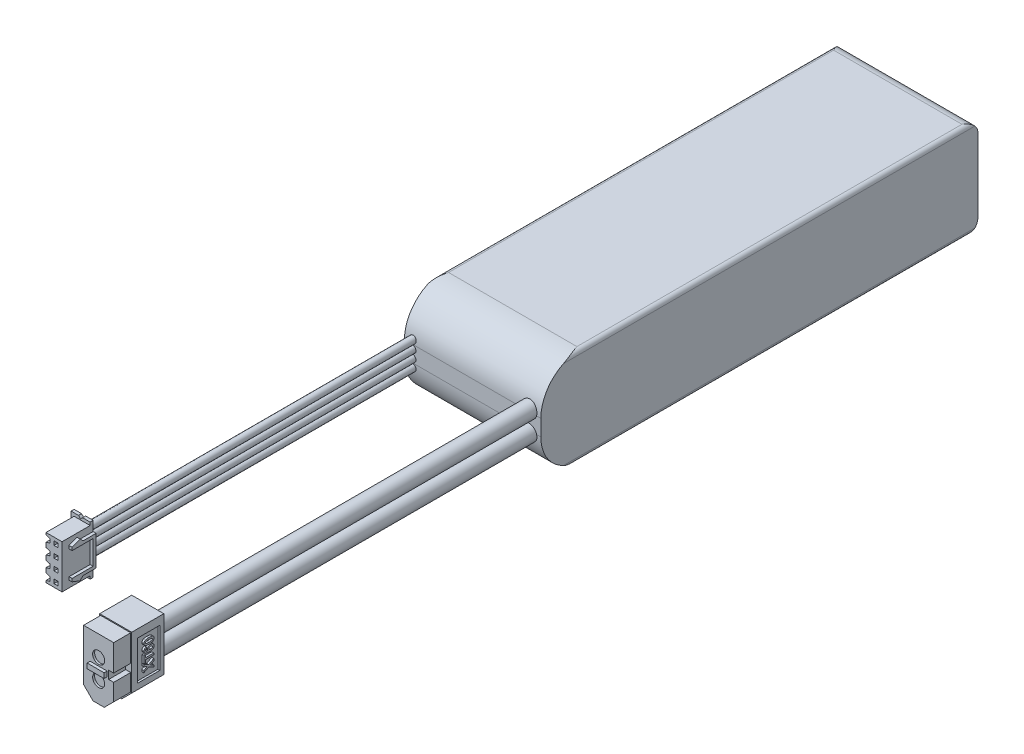
from build123d import *
from OCP.BRepFilletAPI import BRepFilletAPI_MakeFillet

# Parameters (mm, degrees)
SKETCH1_W            = 34
SKETCH1_H            = 24
BOSS_EXTRUDE1_DEPTH  = 109
FILLET1_R1           = 3
FILLET1_R2           = 1
FILLET1_R3           = 10
SKETCH2_R            = 2
BOSS_EXTRUDE6_DEPTH  = 8
BOSS_EXTRUDE7_START  = 8
BOSS_EXTRUDE7_DEPTH  = 4.25
BOSS_EXTRUDE8_START  = 12.25
SKETCH4_5_W          = 4.25
SKETCH4_5_H          = 1.25
BOSS_EXTRUDE8_DEPTH  = 0.75
CUT_EXTRUDE2_START   = 12.25
SKETCH4_7_R          = 1.5
CUT_EXTRUDE2_DEPTH   = 0.5
SKETCH7_W            = 5.5
SKETCH7_H            = 9.75
CUT_EXTRUDE3_DEPTH   = 0.5
BOSS_EXTRUDE12_DEPTH = 0.5
SKETCH9_R            = 0.875
BOSS_EXTRUDE10_DEPTH = 0.75
SKETCH11_4_W         = 4
SKETCH11_4_H         = 10.85
BOSS_EXTRUDE11_DEPTH = 7.75
SKETCH14_W           = 1
SKETCH14_H           = 1
CUT_EXTRUDE4_DEPTH   = 1
CUT_EXTRUDE5_DEPTH   = 3.5
BOSS_EXTRUDE13_DEPTH = 0.75


with BuildPart() as part:
    # Sketch1 → Boss-Extrude1 (new body)
    with BuildSketch(Plane.XY):
        Rectangle(SKETCH1_W, SKETCH1_H)
    extrude(amount=BOSS_EXTRUDE1_DEPTH)

    # Fillet1: one fillet with a radius per group of edges: ONE call of the kernel's fillet builder (fillet() takes one radius for all edges)
    fillet1_edges_1 = [part.edges().sort_by_distance(p)[0] for p in [
        (0, 12, 0),
        (0, -12, 0),
    ]]
    fillet1_edges_2 = [part.edges().sort_by_distance(p)[0] for p in [
        (17, 12, 54.5),
        (-17, 12, 54.5),
        (17, -12, 54.5),
        (-17, -12, 54.5),
    ]]
    fillet1_edges_3 = [part.edges().sort_by_distance(p)[0] for p in [
        (0, 12, 109),
        (0, -12, 109),
    ]]
    fillet1 = BRepFilletAPI_MakeFillet(part.part.solid().wrapped)
    for e in fillet1_edges_1:
        fillet1.Add(FILLET1_R1, e.wrapped)
    for e in fillet1_edges_2:
        fillet1.Add(FILLET1_R2, e.wrapped)
    for e in fillet1_edges_3:
        fillet1.Add(FILLET1_R3, e.wrapped)
    add(Compound.cast(fillet1.Shape()), mode=Mode.REPLACE)

    # Power wires: sweep along a path in Sketch3
    with BuildLine(Plane(origin=(0, 0, 0), x_dir=(1, 0, 0), z_dir=(0, 1, 0))) as power_wires_path:
        Line((14, -204), (14, -109))
        Line((14, -109), (14, -108))
    # Sketch2 → Power wires (sweep)
    with BuildSketch(Plane.XY.offset(109)):
        with Locations((14, -2.5)):
            Circle(SKETCH2_R)
        with Locations((14, 2.5)):
            Circle(SKETCH2_R)
    sweep(path=power_wires_path.line)

    # Sketch4 → Boss-Extrude6 (add)
    with BuildSketch(Plane.XY.offset(204)):
        Polygon((10, -5.325), (12.5, -7.825), (15.5, -7.825), (18, -5.325), (18, 7.825), (10, 7.825), align=None)
    extrude(amount=BOSS_EXTRUDE6_DEPTH)

    # Sketch4<3> → Boss-Extrude7 (add)
    with BuildSketch(Plane.XY.offset(204).offset(BOSS_EXTRUDE7_START)):
        Polygon((10.25, -5.221446609), (12.603553391, -7.575), (15.396446609, -7.575), (17.75, -5.221446609), (17.75, -1), (16.5, -1), (16.5, 1), (17.75, 1), (17.75, 7.575), (10.25, 7.575), align=None)
    extrude(amount=BOSS_EXTRUDE7_DEPTH)

    # Sketch4<5> → Boss-Extrude8 (add)
    with BuildSketch(Plane.XY.offset(204).offset(BOSS_EXTRUDE8_START)):
        with Locations((14, 0)):
            Rectangle(SKETCH4_5_W, SKETCH4_5_H)
    extrude(amount=BOSS_EXTRUDE8_DEPTH)

    # Sketch4<7> → Cut-Extrude2 (cut)
    with BuildSketch(Plane.XY.offset(204).offset(CUT_EXTRUDE2_START)):
        with Locations(Location((14, 2.5, 0), (0, 0, 180))):
            Circle(SKETCH4_7_R)
        with Locations(Location((14, -2.5, 0), (0, 0, 180))):
            Circle(SKETCH4_7_R)
    extrude(amount=-CUT_EXTRUDE2_DEPTH, mode=Mode.SUBTRACT)

    # Sketch7 → Cut-Extrude3 (cut)
    with BuildSketch(Plane(origin=(18, 0, 0), x_dir=(0, 0, -1), z_dir=(1, 0, 0))):
        with Locations((-207.75, 0.95)):
            Rectangle(SKETCH7_W, SKETCH7_H)
    extrude(amount=-CUT_EXTRUDE3_DEPTH, mode=Mode.SUBTRACT)

    # Sketch15 → Boss-Extrude12 (add)
    # profile 1 of 4: a face of its own
    with BuildSketch(Plane(origin=(17.5, 0, 0), x_dir=(0, 0, -1), z_dir=(1, 0, 0))):
        Polygon((-206.5, -0.590039063), (-206.5, -1.122265625), (-207.336914063, -1.540234375), (-206.5, -1.958203125), (-206.5, -2.4875), (-207.758789063, -1.793164063), (-209, -2.454785156), (-209, -1.922558594), (-208.170410156, -1.540234375), (-209, -1.137402344), (-209, -0.608105469), (-207.775878906, -1.281933594), align=None)
    # profile 2 of 4: a face of its own
    with BuildSketch(Plane(origin=(17.5, 0, 0), x_dir=(0, 0, -1), z_dir=(1, 0, 0))):
        Polygon((-208.59375, 1.237597656), (-208.59375, 0.60625), (-206.5, 0.60625), (-206.5, 0.16875), (-208.59375, 0.16875), (-208.59375, -0.51875), (-209, -0.51875), (-209, 1.237597656), align=None)
    # profile 3 of 4: a face of its own
    with BuildSketch(Plane(origin=(17.5, 0, 0), x_dir=(0, 0, -1), z_dir=(1, 0, 0))):
        with BuildLine():
            add(Edge.make_bspline(
                [(-207.291015625, 2.85625), (-207.259578609, 2.855750657), (-207.197863786, 2.854770384), (-207.107626006, 2.845226266), (-207.021769937, 2.830189033), (-206.940308723, 2.80937819), (-206.863295129, 2.7817709), (-206.790505796, 2.748674975), (-206.721811867, 2.709711994), (-206.680033721, 2.678480285), (-206.659179688, 2.662890625)],
                knots=[0, 0, 0, 0, 1.120225603, 2.199143976, 3.230208243, 4.225038561, 5.192076741, 6.142261994, 7.072689081, 8, 8, 8, 8], degree=3))
            add(Edge.make_bspline(
                [(-206.659179688, 2.662890625), (-206.639115856, 2.645710218), (-206.599613072, 2.611884479), (-206.547495154, 2.554956602), (-206.503725826, 2.493377326), (-206.467759306, 2.427724543), (-206.440540963, 2.357665749), (-206.420184986, 2.283967329), (-206.408406954, 2.205750666), (-206.406979671, 2.152187694), (-206.40625, 2.124804687)],
                knots=[0, 0, 0, 0, 1.027724029, 2.023440042, 2.995775062, 3.96270605, 4.929948432, 5.915307429, 6.9342423, 8, 8, 8, 8], degree=3))
            add(Edge.make_bspline(
                [(-206.40625, 2.124804687), (-206.406672975, 2.10591639), (-206.407502435, 2.0688762), (-206.41261802, 2.01425993), (-206.422849325, 1.962215147), (-206.4349811, 1.911961117), (-206.452476991, 1.864629684), (-206.472828839, 1.819366934), (-206.497536166, 1.776642791), (-206.525827888, 1.736149428), (-206.557884062, 1.697812537), (-206.593349233, 1.66152427), (-206.633397711, 1.628509466), (-206.676345382, 1.596933233), (-206.723593622, 1.56828708), (-206.774135834, 1.541351899), (-206.828790219, 1.51741842), (-206.866783615, 1.503507169), (-206.886230469, 1.496386719)],
                knots=[0, 0, 0, 0, 1.063314927, 2.085173921, 3.082384147, 4.046692111, 4.991392734, 5.917883794, 6.837145235, 7.764767902, 8.694920371, 9.647186329, 10.616052668, 11.612884102, 12.645161535, 13.722940264, 14.834490973, 16, 16, 16, 16], degree=3))
            add(Edge.make_bspline(
                [(-206.886230469, 1.496386719), (-206.913638121, 1.487579912), (-206.97134735, 1.469036404), (-207.06404859, 1.44708317), (-207.166603718, 1.428630191), (-207.278754179, 1.413961105), (-207.400676688, 1.401429111), (-207.532477729, 1.393796789), (-207.674101339, 1.387963682), (-207.771802888, 1.387657924), (-207.822265625, 1.3875)],
                knots=[0, 0, 0, 0, 0.729969758, 1.537015714, 2.413984749, 3.3720892, 4.405214479, 5.522074019, 6.720154102, 8, 8, 8, 8], degree=3))
            add(Edge.make_bspline(
                [(-207.822265625, 1.3875), (-207.861347986, 1.387997046), (-207.937837878, 1.388969836), (-208.050022142, 1.398506682), (-208.156909557, 1.413791259), (-208.258325244, 1.435933698), (-208.354429158, 1.463533519), (-208.445035646, 1.49784346), (-208.530467159, 1.538105007), (-208.583589096, 1.570304536), (-208.609863281, 1.586230469)],
                knots=[0, 0, 0, 0, 1.138883295, 2.228961089, 3.278899592, 4.283815446, 5.252133434, 6.190471817, 7.105004804, 8, 8, 8, 8], degree=3))
            add(Edge.make_bspline(
                [(-208.609863281, 1.586230469), (-208.635815625, 1.604092221), (-208.686380041, 1.638893281), (-208.753778427, 1.698702363), (-208.810466702, 1.76359821), (-208.856877328, 1.833197529), (-208.8936599, 1.907378522), (-208.918622313, 1.986826007), (-208.935156729, 2.070571502), (-208.936708234, 2.128140742), (-208.9375, 2.157519531)],
                knots=[0, 0, 0, 0, 1.095943296, 2.135288202, 3.12716094, 4.087262849, 5.039981056, 5.998543803, 6.978614991, 8, 8, 8, 8], degree=3))
            add(Edge.make_bspline(
                [(-208.9375, 2.157519531), (-208.937036875, 2.180486858), (-208.936127884, 2.225565606), (-208.928825827, 2.291598556), (-208.916130293, 2.354325952), (-208.898437607, 2.413567136), (-208.876507077, 2.469820289), (-208.849140422, 2.522774623), (-208.816157903, 2.572055672), (-208.779060869, 2.618142278), (-208.737618316, 2.660154381), (-208.692150647, 2.697369803), (-208.642824388, 2.729384279), (-208.589895609, 2.756207453), (-208.533468968, 2.778254249), (-208.473468254, 2.795293027), (-208.409940244, 2.807777692), (-208.366101858, 2.811422747), (-208.34375, 2.81328125)],
                knots=[0, 0, 0, 0, 1.116390255, 2.191176803, 3.224684108, 4.223596322, 5.19337685, 6.155996882, 7.115032937, 8.07151949, 9.028300563, 9.978646994, 10.922382238, 11.881385651, 12.858530526, 13.862818652, 14.910316285, 16, 16, 16, 16], degree=3))
            Line((-208.34375, 2.81328125), (-208.349609375, 2.436328125))
            add(Edge.make_bspline(
                [(-208.349609375, 2.436328125), (-208.36642363, 2.430304047), (-208.39890429, 2.418667133), (-208.442487517, 2.393933887), (-208.479744502, 2.365566229), (-208.51037456, 2.332677805), (-208.533945793, 2.295213265), (-208.55078775, 2.253399777), (-208.560593678, 2.207286755), (-208.561849472, 2.1751458), (-208.5625, 2.158496094)],
                knots=[0, 0, 0, 0, 1.132133916, 2.186980998, 3.16667511, 4.095341759, 5.024180857, 5.960576271, 6.943534588, 8, 8, 8, 8], degree=3))
            add(Edge.make_bspline(
                [(-208.5625, 2.158496094), (-208.562233125, 2.146249997), (-208.56170911, 2.122204472), (-208.554366375, 2.087328686), (-208.543694594, 2.054107465), (-208.528437003, 2.022707504), (-208.508733386, 1.993127469), (-208.484370132, 1.965827975), (-208.456451487, 1.939513177), (-208.423721502, 1.916027503), (-208.387781946, 1.894604961), (-208.348794159, 1.876080609), (-208.307480877, 1.859761128), (-208.263186179, 1.847468336), (-208.216678859, 1.836767691), (-208.167122405, 1.830452571), (-208.11499936, 1.825744917), (-208.079276247, 1.825251798), (-208.061035156, 1.825)],
                knots=[0, 0, 0, 0, 0.874754798, 1.717603398, 2.53893307, 3.367170322, 4.207036235, 5.073689834, 5.980200498, 6.946958764, 7.949670247, 8.970680773, 10.032653328, 11.123733316, 12.256894092, 13.444472534, 14.695085528, 16, 16, 16, 16], degree=3))
            add(Edge.make_bspline(
                [(-208.061035156, 1.825), (-208.034798217, 1.825527724), (-207.981207926, 1.826605627), (-207.928024558, 1.833301214), (-207.900878906, 1.83671875)],
                knots=[0, 0, 0, 0, 0.979167629, 2, 2, 2, 2], degree=3))
            add(Edge.make_bspline(
                [(-207.900878906, 1.83671875), (-207.916260452, 1.852117482), (-207.945934592, 1.881824777), (-207.984996413, 1.928561301), (-208.018756452, 1.97435997), (-208.045475576, 2.020387074), (-208.066936859, 2.065533352), (-208.082212873, 2.110382579), (-208.092075583, 2.154810034), (-208.093199595, 2.184489859), (-208.09375, 2.199023437)],
                knots=[0, 0, 0, 0, 1.239550291, 2.391345395, 3.467278255, 4.477282722, 5.419075054, 6.310624888, 7.172748962, 8, 8, 8, 8], degree=3))
            add(Edge.make_bspline(
                [(-208.09375, 2.199023437), (-208.093037852, 2.22395175), (-208.091650346, 2.272520623), (-208.082465973, 2.343432725), (-208.066237444, 2.410162562), (-208.04389505, 2.472987368), (-208.014740985, 2.53155637), (-207.979597258, 2.586289347), (-207.937002388, 2.636048581), (-207.889159855, 2.682367043), (-207.834660663, 2.723394897), (-207.774184724, 2.759110087), (-207.707973641, 2.789566512), (-207.635620082, 2.813603359), (-207.557848771, 2.833351373), (-207.474026973, 2.846778554), (-207.384421346, 2.854430612), (-207.32276904, 2.855631496), (-207.291015625, 2.85625)],
                knots=[0, 0, 0, 0, 1.016496444, 1.980482438, 2.909282339, 3.811988147, 4.693512433, 5.571607283, 6.457070192, 7.358310964, 8.282165599, 9.231440416, 10.217383171, 11.247887857, 12.336023617, 13.486034316, 14.705206621, 16, 16, 16, 16], degree=3))
        make_face()
        with BuildLine():
            add(Edge.make_bspline(
                [(-207.321777344, 2.45), (-207.338227707, 2.449918888), (-207.370365182, 2.449760427), (-207.416934214, 2.445458039), (-207.460921241, 2.440055818), (-207.5017324, 2.430926272), (-207.540194337, 2.420670938), (-207.575340764, 2.406504429), (-207.608345019, 2.391441402), (-207.637642421, 2.372510861), (-207.663956703, 2.35210652), (-207.687471492, 2.330181823), (-207.706409848, 2.305498888), (-207.722076544, 2.279358745), (-207.735275822, 2.251781974), (-207.743864934, 2.221920829), (-207.748702733, 2.190229307), (-207.74956039, 2.168604013), (-207.75, 2.157519531)],
                knots=[0, 0, 0, 0, 1.354073793, 2.645322252, 3.849077002, 5.00057718, 6.086883735, 7.12238405, 8.117628637, 9.069598867, 9.986576526, 10.858766831, 11.708735397, 12.538596173, 13.366180532, 14.218681913, 15.086949458, 16, 16, 16, 16], degree=3))
            add(Edge.make_bspline(
                [(-207.75, 2.157519531), (-207.749675408, 2.145932811), (-207.749034811, 2.123065867), (-207.742371331, 2.089400595), (-207.731671961, 2.057257876), (-207.716831767, 2.026507413), (-207.697586611, 1.997460364), (-207.673720561, 1.970195973), (-207.646521896, 1.943530949), (-207.614543776, 1.919528251), (-207.57978207, 1.896826739), (-207.541282058, 1.87821529), (-207.500629213, 1.861010291), (-207.456546462, 1.848464862), (-207.410215604, 1.837328987), (-207.360853822, 1.830268452), (-207.30884133, 1.825791144), (-207.273121981, 1.825267424), (-207.254882813, 1.825)],
                knots=[0, 0, 0, 0, 0.838204484, 1.654236536, 2.474259819, 3.286109908, 4.119743769, 4.989110372, 5.906075801, 6.872682158, 7.879764388, 8.907669703, 9.964892519, 11.072432114, 12.221831409, 13.413718623, 14.679381833, 16, 16, 16, 16], degree=3))
            add(Edge.make_bspline(
                [(-207.254882813, 1.825), (-207.225022303, 1.825959846), (-207.167275352, 1.827816082), (-207.084074445, 1.844155328), (-207.008318627, 1.871520346), (-206.951210575, 1.903159429), (-206.910997606, 1.932846375), (-206.884714023, 1.956466093), (-206.862510827, 1.981478143), (-206.844391265, 2.007936401), (-206.829957577, 2.03558834), (-206.819529023, 2.064612243), (-206.813636777, 2.095105601), (-206.812880855, 2.115828678), (-206.8125, 2.126269531)],
                knots=[0, 0, 0, 0, 1.815779699, 3.511518798, 5.134513937, 6.699693824, 7.46432505, 8.172542783, 8.84618875, 9.494530984, 10.119137765, 10.739410505, 11.364880491, 12, 12, 12, 12], degree=3))
            add(Edge.make_bspline(
                [(-206.8125, 2.126269531), (-206.812749449, 2.138357582), (-206.813235885, 2.161929827), (-206.82074339, 2.196110039), (-206.831201327, 2.228849281), (-206.847058515, 2.259402438), (-206.866751922, 2.288413868), (-206.891693222, 2.314540501), (-206.920081994, 2.339889704), (-206.953268824, 2.362439654), (-206.989837063, 2.382719823), (-207.029027768, 2.401073111), (-207.071174132, 2.415898103), (-207.115772086, 2.428825956), (-207.163298248, 2.438466069), (-207.213699924, 2.445257984), (-207.266868318, 2.449063934), (-207.303216841, 2.449683588), (-207.321777344, 2.45)],
                knots=[0, 0, 0, 0, 0.862241869, 1.68141048, 2.49085395, 3.312991769, 4.132738568, 4.988993667, 5.887599157, 6.849365453, 7.849495963, 8.875021322, 9.938647566, 11.039794136, 12.192122389, 13.401539835, 14.673158577, 16, 16, 16, 16], degree=3))
        make_face(mode=Mode.SUBTRACT)
    # profile 4 of 4: a face of its own
    with BuildSketch(Plane(origin=(17.5, 0, 0), x_dir=(0, 0, -1), z_dir=(1, 0, 0))):
        with BuildLine():
            add(Edge.make_bspline(
                [(-207.6875, 4.54375), (-207.641433186, 4.543365535), (-207.552359392, 4.542622141), (-207.423229985, 4.537206094), (-207.303196607, 4.528590223), (-207.192220396, 4.516635797), (-207.090446004, 4.5008396), (-206.998169496, 4.480561945), (-206.914422008, 4.458472287), (-206.862979225, 4.438867393), (-206.838378906, 4.429492187)],
                knots=[0, 0, 0, 0, 1.283351493, 2.481460683, 3.599894811, 4.6354175, 5.590360189, 6.467286743, 7.267045185, 8, 8, 8, 8], degree=3))
            add(Edge.make_bspline(
                [(-206.838378906, 4.429492187), (-206.822150954, 4.422404625), (-206.790166393, 4.408435359), (-206.744876445, 4.383716884), (-206.702120915, 4.357650308), (-206.663088264, 4.32850871), (-206.62662974, 4.297934608), (-206.593952595, 4.264455957), (-206.564084358, 4.229224064), (-206.536901229, 4.192085392), (-206.513683402, 4.152285547), (-206.492813337, 4.110701701), (-206.476018999, 4.066573624), (-206.461560544, 4.020514042), (-206.451079716, 3.972093481), (-206.443310673, 3.92171279), (-206.438159607, 3.869214462), (-206.437722902, 3.833475967), (-206.4375, 3.815234375)],
                knots=[0, 0, 0, 0, 1.083396424, 2.1353254, 3.155448726, 4.145753585, 5.113963313, 6.065004106, 7.005128718, 7.939747428, 8.87775821, 9.822306467, 10.784345916, 11.764374699, 12.774721821, 13.813166405, 14.883799469, 16, 16, 16, 16], degree=3))
            add(Edge.make_bspline(
                [(-206.4375, 3.815234375), (-206.437722863, 3.796992764), (-206.43815949, 3.761254231), (-206.443311115, 3.708756173), (-206.451078131, 3.658374506), (-206.461566215, 3.609957438), (-206.47599868, 3.563885347), (-206.492939446, 3.519666008), (-206.513549287, 3.477793801), (-206.536895522, 3.437884293), (-206.564240788, 3.400726209), (-206.593786114, 3.36506147), (-206.626630245, 3.331546187), (-206.663244324, 3.301035548), (-206.701937821, 3.271262423), (-206.745025502, 3.245383073), (-206.79012602, 3.220045057), (-206.822140956, 3.205773619), (-206.838378906, 3.198535156)],
                knots=[0, 0, 0, 0, 1.114012558, 2.182546968, 3.218955996, 4.227322638, 5.205430371, 6.165584032, 7.117205123, 8.053377218, 8.986163891, 9.932053842, 10.881230407, 11.847542252, 12.841839694, 13.859963376, 14.914575071, 16, 16, 16, 16], degree=3))
            add(Edge.make_bspline(
                [(-206.838378906, 3.198535156), (-206.863307574, 3.188552969), (-206.915542805, 3.167636413), (-207.000035129, 3.142741534), (-207.093427252, 3.122042099), (-207.195227744, 3.104376726), (-207.305955568, 3.091693451), (-207.425308749, 3.081857313), (-207.553490731, 3.076053482), (-207.641921205, 3.075358307), (-207.6875, 3.075)],
                knots=[0, 0, 0, 0, 0.746149865, 1.563473513, 2.44485867, 3.404393639, 4.43419012, 5.541857693, 6.733025404, 8, 8, 8, 8], degree=3))
            add(Edge.make_bspline(
                [(-207.6875, 3.075), (-207.733078795, 3.075358307), (-207.821509269, 3.076053482), (-207.949691251, 3.081857313), (-208.069044432, 3.091693451), (-208.179772256, 3.104376726), (-208.281572748, 3.122042099), (-208.374964871, 3.142741534), (-208.459457195, 3.167636413), (-208.511692426, 3.188552969), (-208.536621094, 3.198535156)],
                knots=[0, 0, 0, 0, 1.266974596, 2.458142307, 3.56580988, 4.595606361, 5.55514133, 6.436526487, 7.253850135, 8, 8, 8, 8], degree=3))
            add(Edge.make_bspline(
                [(-208.536621094, 3.198535156), (-208.552859044, 3.205773619), (-208.58487398, 3.220045057), (-208.629974498, 3.245383073), (-208.673062179, 3.271262423), (-208.711755676, 3.301035548), (-208.748369755, 3.331546187), (-208.781213886, 3.36506147), (-208.810759212, 3.400726209), (-208.838104478, 3.437884293), (-208.861450713, 3.477793801), (-208.882060554, 3.519666008), (-208.89900132, 3.563885347), (-208.913433785, 3.609957438), (-208.923921869, 3.658374506), (-208.931688885, 3.708756173), (-208.93684051, 3.761254231), (-208.937277137, 3.796992764), (-208.9375, 3.815234375)],
                knots=[0, 0, 0, 0, 1.085424929, 2.140036624, 3.158160306, 4.152457748, 5.118769593, 6.067946158, 7.013836109, 7.946622782, 8.882794877, 9.834415968, 10.794569629, 11.772677362, 12.781044004, 13.817453032, 14.885987442, 16, 16, 16, 16], degree=3))
            add(Edge.make_bspline(
                [(-208.9375, 3.815234375), (-208.937277098, 3.833475967), (-208.936840393, 3.869214462), (-208.931689327, 3.92171279), (-208.923920284, 3.972093481), (-208.913439456, 4.020514042), (-208.898981001, 4.066573624), (-208.882186663, 4.110701701), (-208.861316598, 4.152285547), (-208.838098771, 4.192085392), (-208.810915642, 4.229224064), (-208.781047405, 4.264455957), (-208.74837026, 4.297934608), (-208.711911736, 4.32850871), (-208.672879085, 4.357650308), (-208.630123555, 4.383716884), (-208.584833607, 4.408435359), (-208.552849046, 4.422404625), (-208.536621094, 4.429492187)],
                knots=[0, 0, 0, 0, 1.116200531, 2.186833595, 3.225278179, 4.235625301, 5.215654084, 6.177693533, 7.12224179, 8.060252572, 8.994871282, 9.934995894, 10.886036687, 11.854246415, 12.844551274, 13.8646746, 14.916603576, 16, 16, 16, 16], degree=3))
            add(Edge.make_bspline(
                [(-208.536621094, 4.429492187), (-208.512020775, 4.438867393), (-208.460577992, 4.458472287), (-208.376830504, 4.480561945), (-208.284553996, 4.5008396), (-208.182779604, 4.516635797), (-208.071803393, 4.528590223), (-207.951770015, 4.537206094), (-207.822640608, 4.542622141), (-207.733566814, 4.543365535), (-207.6875, 4.54375)],
                knots=[0, 0, 0, 0, 0.732954815, 1.532713257, 2.409639811, 3.3645825, 4.400105189, 5.518539317, 6.716648507, 8, 8, 8, 8], degree=3))
        make_face()
        with BuildLine():
            add(Edge.make_bspline(
                [(-207.6875, 4.10625), (-207.726238072, 4.106212522), (-207.800301839, 4.106140867), (-207.906102402, 4.104075588), (-208.001325941, 4.10120593), (-208.085997157, 4.097546746), (-208.160079196, 4.09222078), (-208.223570228, 4.085898034), (-208.276681568, 4.079236435), (-208.308141118, 4.072268875), (-208.322265625, 4.069140625)],
                knots=[0, 0, 0, 0, 1.45986549, 2.791133683, 3.987797471, 5.050084811, 5.984865889, 6.786241445, 7.455054459, 8, 8, 8, 8], degree=3))
            add(Edge.make_bspline(
                [(-208.322265625, 4.069140625), (-208.338683834, 4.064001173), (-208.370119008, 4.054160906), (-208.413350216, 4.033642377), (-208.449772485, 4.00815513), (-208.480017708, 3.978309745), (-208.503172347, 3.943732448), (-208.519517007, 3.904599718), (-208.529334695, 3.861287549), (-208.530597993, 3.830911764), (-208.53125, 3.815234375)],
                knots=[0, 0, 0, 0, 1.152711699, 2.207042953, 3.194101924, 4.120148214, 5.040323797, 5.964632119, 6.949516683, 8, 8, 8, 8], degree=3))
            add(Edge.make_bspline(
                [(-208.53125, 3.815234375), (-208.530616034, 3.799227344), (-208.529393465, 3.768358649), (-208.519399191, 3.724309287), (-208.503345844, 3.684392465), (-208.479860542, 3.649260103), (-208.450011858, 3.61836426), (-208.413233011, 3.592554851), (-208.370304232, 3.570796107), (-208.338716068, 3.560717483), (-208.322265625, 3.55546875)],
                knots=[0, 0, 0, 0, 1.059442226, 2.043077028, 2.976241166, 3.894394316, 4.824750626, 5.806255322, 6.857544481, 8, 8, 8, 8], degree=3))
            add(Edge.make_bspline(
                [(-208.322265625, 3.55546875), (-208.307666935, 3.551797789), (-208.275485864, 3.543705594), (-208.221262665, 3.536448479), (-208.157243406, 3.528017925), (-208.082877186, 3.522994014), (-207.998437433, 3.517587454), (-207.903809759, 3.515452858), (-207.799009255, 3.512387454), (-207.725751862, 3.512461392), (-207.6875, 3.5125)],
                knots=[0, 0, 0, 0, 0.566279449, 1.248295455, 2.056950156, 2.997321868, 4.053014892, 5.242299447, 6.560047274, 8, 8, 8, 8], degree=3))
            add(Edge.make_bspline(
                [(-207.6875, 3.5125), (-207.649248687, 3.512478029), (-207.575992347, 3.512435951), (-207.471179247, 3.515285108), (-207.376397105, 3.518129583), (-207.291938353, 3.52379571), (-207.217639038, 3.529760272), (-207.153627022, 3.537526664), (-207.099534155, 3.546250988), (-207.067337191, 3.5546081), (-207.052734375, 3.558398437)],
                knots=[0, 0, 0, 0, 1.439145037, 2.756153721, 3.944976259, 5.006561833, 5.940802902, 6.749004018, 7.432615295, 8, 8, 8, 8], degree=3))
            add(Edge.make_bspline(
                [(-207.052734375, 3.558398437), (-207.036310909, 3.563532807), (-207.004865669, 3.573363344), (-206.96170357, 3.593948681), (-206.92485224, 3.619339432), (-206.895310324, 3.650198453), (-206.87164618, 3.684839142), (-206.855519548, 3.724444256), (-206.845619909, 3.768362126), (-206.844388533, 3.799228531), (-206.84375, 3.815234375)],
                knots=[0, 0, 0, 0, 1.144409448, 2.191147024, 3.171096836, 4.105921935, 5.019470078, 5.947109441, 6.935468946, 8, 8, 8, 8], degree=3))
            add(Edge.make_bspline(
                [(-206.84375, 3.815234375), (-206.844402007, 3.830911764), (-206.845665305, 3.861287549), (-206.855482993, 3.904599718), (-206.871827653, 3.943732448), (-206.894982292, 3.978309745), (-206.925227515, 4.00815513), (-206.961649784, 4.033642377), (-207.004880992, 4.054160906), (-207.036316166, 4.064001173), (-207.052734375, 4.069140625)],
                knots=[0, 0, 0, 0, 1.050483317, 2.035367881, 2.959676203, 3.879851786, 4.805898076, 5.792957047, 6.847288301, 8, 8, 8, 8], degree=3))
            add(Edge.make_bspline(
                [(-207.052734375, 4.069140625), (-207.066858891, 4.072268751), (-207.09831846, 4.079236032), (-207.151429622, 4.085900251), (-207.214760023, 4.092193906), (-207.288837493, 4.097588013), (-207.373512401, 4.10118528), (-207.468897329, 4.104080527), (-207.574698239, 4.106139432), (-207.648761955, 4.106212029), (-207.6875, 4.10625)],
                knots=[0, 0, 0, 0, 0.544944887, 1.213757099, 2.015131694, 2.943793929, 4.012207312, 5.208869664, 6.540136261, 8, 8, 8, 8], degree=3))
        make_face(mode=Mode.SUBTRACT)
    extrude(amount=BOSS_EXTRUDE12_DEPTH)

    # Balance wires: sweep along a path in Sketch10
    with BuildLine() as balance_wires_path:  # in the path sketch's own coordinates; laid on its plane below (add() does not lay a ready-made edge on the line's plane)
        Line((-15, -108), (-15, -109))
        add(Edge.make_bspline(
            [(-15, -109), (-15, -150), (-15, -191)],
            knots=[0, 0, 0, 1, 1, 1], degree=2))
    # Sketch9 → Balance wires (sweep)
    with BuildSketch(Plane.XY.offset(109)):
        with Locations((-15, 3)):
            Circle(SKETCH9_R)
        with Locations((-15, 1)):
            Circle(SKETCH9_R)
        with Locations((-15, -1)):
            Circle(SKETCH9_R)
        with Locations((-15, -3)):
            Circle(SKETCH9_R)
    sweep(path=Plane(origin=(0, 0, 0), x_dir=(1, 0, 0), z_dir=(0, 1, 0)) * balance_wires_path.line)

    # Sketch11 → Boss-Extrude10 (add)
    with BuildSketch(Plane.XY.offset(191)):
        Polygon((-17.375, 6.175), (-15.5, 6.175), (-15, 5.675), (-14.5, 6.175), (-12.625, 6.175), (-12.625, -6.175), (-17.375, -6.175), align=None)
    extrude(amount=BOSS_EXTRUDE10_DEPTH)

    # Sketch11<4> → Boss-Extrude11 (add)
    with BuildSketch(Plane.XY.offset(191)):
        with Locations((-14.625, 0)):
            Rectangle(SKETCH11_4_W, SKETCH11_4_H)
    extrude(amount=BOSS_EXTRUDE11_DEPTH)

    # Sketch14 → Cut-Extrude4 (cut)
    with BuildSketch(Plane.XY.offset(198.75)):
        with Locations((-14.125, 4.124194837)):
            Rectangle(SKETCH14_W, SKETCH14_H)
        with Locations((-14.125, 1.374731612)):
            Rectangle(SKETCH14_W, SKETCH14_H)
        with Locations((-14.125, -1.374731612)):
            Rectangle(SKETCH14_W, SKETCH14_H)
        with Locations((-14.125, -4.124194837)):
            Rectangle(SKETCH14_W, SKETCH14_H)
    extrude(amount=-CUT_EXTRUDE4_DEPTH, mode=Mode.SUBTRACT)

    # Sketch14<3> → Cut-Extrude5 (cut)
    with BuildSketch(Plane.XY.offset(198.75)):
        Polygon((-15.625, 1.874463224), (-16.625, 2.175268388), (-16.625, 0.574463224), (-15.625, 0.874463224), align=None)
        Polygon((-15.625, -0.875268388), (-16.625, -0.574463224), (-16.625, -2.175268388), (-15.625, -1.875268388), align=None)
        Polygon((-15.625, -3.625), (-16.625, -3.324194837), (-16.625, -4.925), (-15.625, -4.625), align=None)
        Polygon((-16.625, 3.324194837), (-16.625, 4.925), (-15.625, 4.624194837), (-15.625, 3.624194837), align=None)
    extrude(amount=-CUT_EXTRUDE5_DEPTH, mode=Mode.SUBTRACT)

    # Sketch17 → Boss-Extrude13 (add)
    with BuildSketch(Plane(origin=(-12.625, 0, 0), x_dir=(0, 0, -1), z_dir=(1, 0, 0))):
        Polygon((-191, 3.75), (-191, -3.75), (-194.25, -3.75), (-195, -4.5), (-197, -3.75), (-197, -3), (-191.75, -3), (-191.75, 3), (-197, 3), (-197, 3.75), (-195, 4.5), (-194.25, 3.75), align=None)
    extrude(amount=BOSS_EXTRUDE13_DEPTH)


solid = part.part
